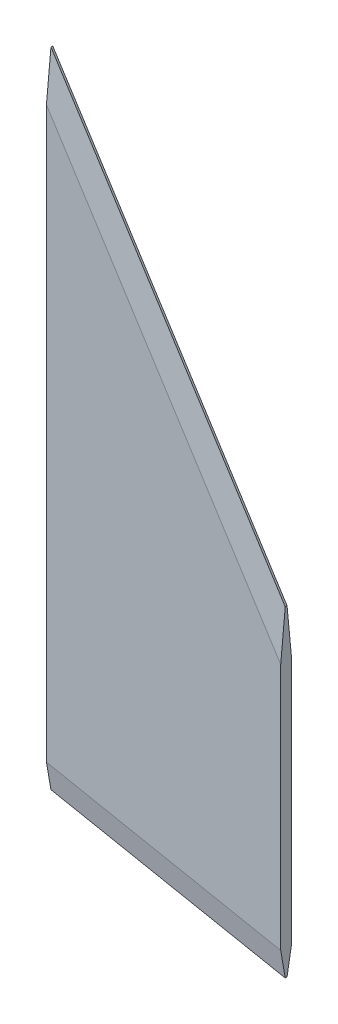
from build123d import *
from OCP.BRepFilletAPI import BRepFilletAPI_MakeChamfer

# Parameters (mm, degrees)
BOSS_EXTRUDE1_DEPTH = 1.5
CHAMFER1_SIZE       = 1.25
CHAMFER1_SIZE2      = 7.089102275


with BuildPart() as part:
    # Sketch1 → Boss-Extrude1 (new, symmetric)
    with BuildSketch(Plane.XY):
        Polygon((-60.98159975, 99.331512683), (-60.98159975, -78.468487317), (3.78840025, -91.168487317), (3.78840025, -2.268487317), align=None)
    extrude(amount=BOSS_EXTRUDE1_DEPTH, both=True)

    # Chamfer1: one chamfer whose edges measure the first distance from different faces: ONE call of the kernel's chamfer builder (chamfer() names one face for all edges)
    chamfer1_edges_1 = [part.edges().sort_by_distance(p)[0] for p in [
        (-28.59659975, -84.818487317, 1.5),
        (-28.59659975, -84.818487317, -1.5),
    ]]
    chamfer1_side_1 = [part.faces().sort_by_distance(p)[0] for p in [
        (-28.59659975, -84.818487317, 0),
    ]]
    chamfer1_edges_2 = [part.edges().sort_by_distance(p)[0] for p in [
        (-28.59659975, 48.531512683, 1.5),
        (-28.59659975, 48.531512683, -1.5),
    ]]
    chamfer1_side_2 = [part.faces().sort_by_distance(p)[0] for p in [
        (-28.59659975, 48.531512683, 0),
    ]]
    chamfer1 = BRepFilletAPI_MakeChamfer(part.part.solid().wrapped)
    for e in chamfer1_edges_1:
        chamfer1.Add(CHAMFER1_SIZE, CHAMFER1_SIZE2, e.wrapped, chamfer1_side_1[0].wrapped)  # the first distance lies on this face
    for e in chamfer1_edges_2:
        chamfer1.Add(CHAMFER1_SIZE, CHAMFER1_SIZE2, e.wrapped, chamfer1_side_2[0].wrapped)  # the first distance lies on this face
    add(Compound.cast(chamfer1.Shape()), mode=Mode.REPLACE)


solid = part.part
